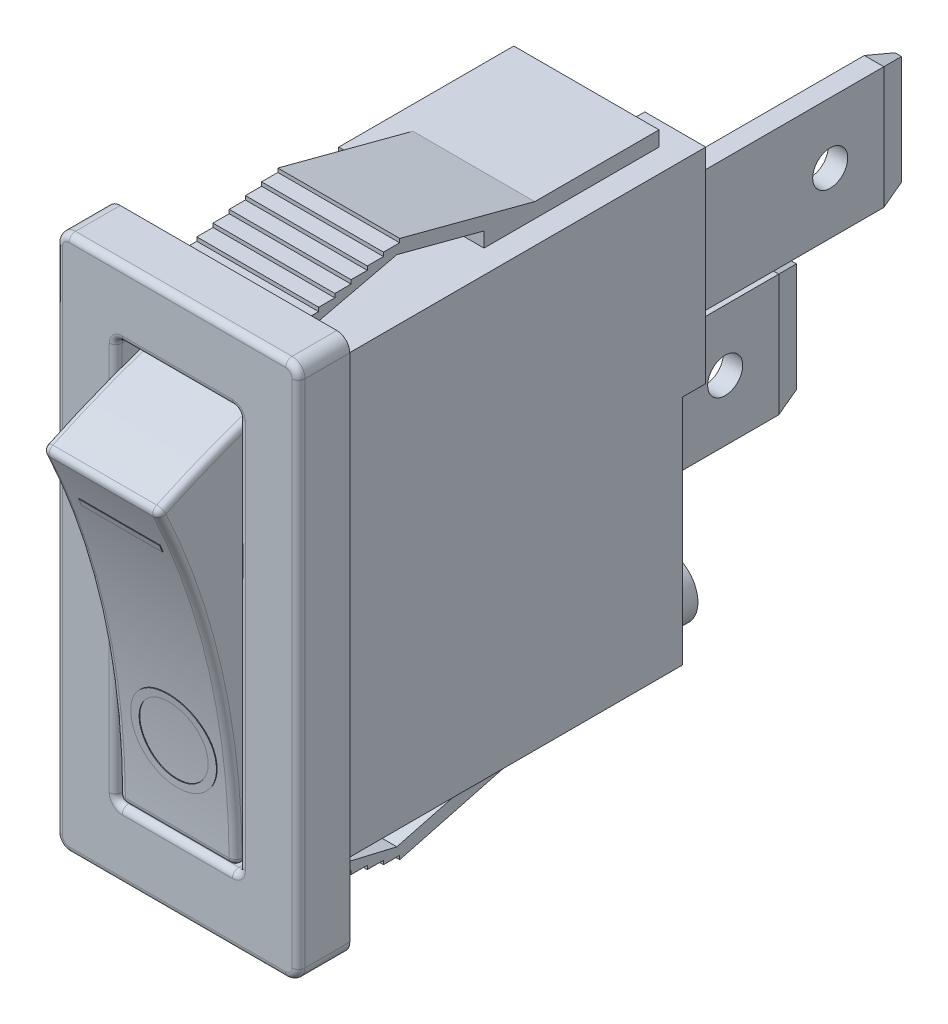
from build123d import *

# Parameters (mm, degrees)
EXTRUDE1_DEPTH      = 3.302
EXTRUDE2_DEPTH      = 2.3876
SKETCH5_W           = 0.9144
SKETCH5_H           = 0.5842
EXTRUDE3_DEPTH      = 19.210666352
SKETCH6_W           = 9.4996
SKETCH6_H           = 21.0058
SKETCH6_W_2         = 4.826
SKETCH6_H_2         = 15.748
EXTRUDE4_DEPTH      = 2.0066
FILLET1_R           = 0.508
FILLET2_R           = 0.254
SKETCH8_R           = 1.2192
EXTRUDE6_DEPTH      = 0.9144
SKETCH9_W           = 0.762
SKETCH9_H           = 4.7752
EXTRUDE7_DEPTH      = 9.7028
EXTRUDE7_2_DEPTH    = 9.7028
SKETCH10_R          = 0.6858
EXTRUDE8_DEPTH      = 28.340336298
CHAMFER1_SIZE       = 0.254
CHAMFER1_SIZE2      = 0.947940905
CHAMFER2_SIZE       = 0.254
CHAMFER2_SIZE2      = 0.947940905
EXTRUDE5_DEPTH      = 2.286
FILLET3_R           = 0.254
EXTRUDE9_REACH      = 34.854
EXTRUDE9_END_RADIUS = 31.334303465
EXTRUDE9_START      = -2.54
SKETCH12_W          = 3.175
SKETCH12_H          = 0.284935898


with BuildPart() as part:
    # Sketch3 → Extrude1 (new, symmetric)
    with BuildSketch(Plane(origin=(0, 0, 0), x_dir=(0, 0, -1), z_dir=(1, 0, 0))):
        Polygon((0, 8.5598), (0, -8.5598), (7.62, -8.5598), (7.62, -9.144), (14.478, -9.144), (14.478, 9.144), (7.62, 9.144), (7.62, 8.5598), align=None)
    extrude(amount=EXTRUDE1_DEPTH, both=True)

    # Sketch4 → Extrude2 (add, symmetric)
    with BuildSketch(Plane(origin=(0, 0, 0), x_dir=(0, 0, -1), z_dir=(1, 0, 0))):
        Polygon((7.62, 9.144), (4.20640573, 10.045056952), (0, 9.055314427), (0, 9.525), (0.508, 9.644529412), (1.143, 9.644529412), (1.143, 9.793941176), (1.778, 9.793941176), (1.778, 9.943352941), (2.413, 9.943352941), (2.413, 10.092764706), (3.048, 10.092764706), (3.048, 10.242176471), (3.683, 10.242176471), (3.683, 10.391588235), (4.318, 10.391588235), (4.318, 10.541), (9.610441485, 9.144), align=None)
        Polygon((1.143, -9.644529412), (0.508, -9.644529412), (0, -9.525), (0, -9.055314427), (4.20640573, -10.045056952), (7.62, -9.144), (9.610441485, -9.144), (4.318, -10.541), (4.318, -10.391588235), (3.683, -10.391588235), (3.683, -10.242176471), (3.048, -10.242176471), (3.048, -10.092764706), (2.413, -10.092764706), (2.413, -9.943352941), (1.778, -9.943352941), (1.778, -9.793941176), (1.143, -9.793941176), align=None)
    extrude(amount=EXTRUDE2_DEPTH, both=True)

    # Sketch5 → Extrude3 (cut, through all)
    with BuildSketch(Plane.XY):
        with Locations((2.8448, 8.8519)):
            Rectangle(SKETCH5_W, SKETCH5_H)
        with Locations((2.8448, -8.8519)):
            Rectangle(SKETCH5_W, SKETCH5_H)
    extrude(amount=-EXTRUDE3_DEPTH, mode=Mode.SUBTRACT)

    # Sketch6 → Extrude4 (add)
    with BuildSketch(Plane.XY):
        Rectangle(SKETCH6_W, SKETCH6_H)
        Rectangle(SKETCH6_W_2, SKETCH6_H_2, mode=Mode.SUBTRACT)
    extrude(amount=EXTRUDE4_DEPTH)

    # Fillet1
    fillet1_edges = [part.edges().sort_by_distance(p)[0] for p in [
        (-4.7498, 10.5029, 1.0033),
        (-4.7498, -10.5029, 1.0033),
        (4.7498, -10.5029, 1.0033),
        (4.7498, 10.5029, 1.0033),
    ]]
    fillet(fillet1_edges, radius=FILLET1_R)

    # Fillet2
    fillet2_edges = [part.edges().sort_by_distance(p)[0] for p in [
        (2.413, 0, 2.0066),
        (2.413, 7.874, 1.0033),
        (0, 7.874, 2.0066),
        (-2.413, 7.874, 1.0033),
        (-2.413, 0, 2.0066),
        (-2.413, -7.874, 1.0033),
        (0, -7.874, 2.0066),
        (2.413, -7.874, 1.0033),
        (-4.7498, 0, 2.0066),
        (0, 10.5029, 2.0066),
        (0, -10.5029, 2.0066),
        (4.7498, 0, 2.0066),
        (4.601010245, 10.354110245, 2.0066),
        (4.601010245, -10.354110245, 2.0066),
        (-4.601010245, -10.354110245, 2.0066),
        (-4.601010245, 10.354110245, 2.0066),
    ]]
    fillet(fillet2_edges, radius=FILLET2_R)

    # Sketch8 → Extrude6 (add)
    with BuildSketch(Plane(origin=(0, 0, -14.478), x_dir=(-1, 0, 0), z_dir=(0, 0, -1))):
        with Locations(Location((-1.778, -7.0358, 0), (0, 0, 180))):
            Circle(SKETCH8_R)
        Polygon((-0.9144, 2.8448), (-0.9144, 0.5334), (-3.302, 0.5334), (-3.302, 8.5598), (-0.9144, 8.5598), (-0.9144, 6.2484), (-2.4384, 6.2484), (-2.4384, 2.8448), align=None)
        Polygon((0.9144, -0.5334), (3.302, -0.5334), (3.302, -8.5598), (0.9144, -8.5598), (0.9144, -6.2484), (2.4384, -6.2484), (2.4384, -2.8448), (0.9144, -2.8448), align=None)
    extrude(amount=EXTRUDE6_DEPTH)


with BuildPart() as body_2:
    # Sketch9 → Extrude7 (new body)
    with BuildSketch(Plane(origin=(0, 0, -14.478), x_dir=(-1, 0, 0), z_dir=(0, 0, -1))):
        with Locations((-2.0574, 4.5466)):
            Rectangle(SKETCH9_W, SKETCH9_H)
    extrude(amount=EXTRUDE7_DEPTH)


with BuildPart() as body_3:
    # Sketch9 → Extrude7 2 (new body)
    with BuildSketch(Plane(origin=(0, 0, -14.478), x_dir=(-1, 0, 0), z_dir=(0, 0, -1))):
        with Locations((2.0574, -4.5466)):
            Rectangle(SKETCH9_W, SKETCH9_H)
    extrude(amount=EXTRUDE7_2_DEPTH)


with BuildPart() as extrude8_tool:
    # Sketch10 → Extrude8 (new, through all)
    with BuildSketch(Plane(origin=(2.4384, 0, 0), x_dir=(0, 0, -1), z_dir=(1, 0, 0))):
        with Locations(Location((21.1328, 4.5466, 0), (0, 0, 90))):
            Circle(SKETCH10_R)
        with Locations(Location((21.1328, -4.5466, 0), (0, 0, 180))):
            Circle(SKETCH10_R)
    extrude(amount=-EXTRUDE8_DEPTH)


with BuildPart() as body_2_1:
    add(body_2.part)

    # Extrude8: cut by extrude8_tool
    add(extrude8_tool.part, mode=Mode.SUBTRACT)

    # Chamfer1
    chamfer1_edges = [body_2_1.edges().sort_by_distance(p)[0] for p in [
        (1.6764, 4.5466, -24.1808),
        (2.0574, 6.9342, -24.1808),
        (2.4384, 4.5466, -24.1808),
        (2.0574, 2.159, -24.1808),
    ]]
    chamfer1_side = [body_2_1.faces().sort_by_distance(p)[0] for p in [
        (2.0574, 4.5466, -24.1808),
    ]]
    chamfer(chamfer1_edges, length=CHAMFER1_SIZE, length2=CHAMFER1_SIZE2, reference=chamfer1_side[0])


with BuildPart() as body_3_1:
    add(body_3.part)

    # Extrude8: cut by extrude8_tool
    add(extrude8_tool.part, mode=Mode.SUBTRACT)

    # Chamfer2
    chamfer2_edges = [body_3_1.edges().sort_by_distance(p)[0] for p in [
        (-1.6764, -4.5466, -24.1808),
        (-2.0574, -6.9342, -24.1808),
        (-2.4384, -4.5466, -24.1808),
        (-2.0574, -2.159, -24.1808),
    ]]
    chamfer2_side = [body_3_1.faces().sort_by_distance(p)[0] for p in [
        (-2.0574, -4.5466, -24.1808),
    ]]
    chamfer(chamfer2_edges, length=CHAMFER2_SIZE, length2=CHAMFER2_SIZE2, reference=chamfer2_side[0])


with BuildPart() as body_4:
    # Sketch7 → Extrude5 (new, symmetric)
    with BuildSketch(Plane(origin=(0, 0, 0), x_dir=(0, 0, -1), z_dir=(1, 0, 0))):
        with BuildLine():
            Line((3.419415582, -7.316747599), (0, 7.747))
            ThreePointArc((0, 7.747), (-2.578685969, 6.870258684), (-5.08, 5.792425309))
            ThreePointArc((-5.08, 5.792425309), (-2.784600682, -0.805065377), (-2.0066, -7.747))
            ThreePointArc((-2.0066, -7.747), (0.714923573, -7.639268351), (3.419415582, -7.316747599))
        make_face()
    extrude(amount=EXTRUDE5_DEPTH, both=True)

    # Fillet3
    fillet3_edges = [body_4.edges().sort_by_distance(p)[0] for p in [
        (2.286, -7.639268351, -0.714923573),
        (2.286, 6.870258684, 2.578685969),
        (-2.286, -7.639268351, -0.714923573),
        (-2.286, -0.805065377, 2.784600682),
        (-2.286, 6.870258684, 2.578685969),
        (2.286, -0.805065377, 2.784600682),
        (0, -7.747, 2.0066),
        (0, 5.792425309, 5.08),
    ]]
    fillet(fillet3_edges, radius=FILLET3_R)

    # Extrude9: up to this cylinder (the profile starts outside it)
    extrude9_end = Plane(origin=(-0.516007, -7.747, 33.366303465), z_dir=(-1, 0, 0)) * Cylinder(EXTRUDE9_END_RADIUS, 134.53562093, mode=Mode.PRIVATE)
    # Sketch12 → Extrude9 (add, up to the surface)
    with BuildSketch(Plane(origin=(0, -0.800620142, 3.527017833), x_dir=(1, 0, 0), z_dir=(0, -0.22136480439331788, 0.9751910701887647)).offset(EXTRUDE9_START), mode=Mode.PRIVATE) as extrude9_sk1:
        with Locations((0.0635, 4.79734566)):
            Rectangle(SKETCH12_W, SKETCH12_H)
    extrude9_tool1 = extrude(extrude9_sk1.sketch, amount=EXTRUDE9_REACH, mode=Mode.PRIVATE) - extrude9_end
    add(extrude9_tool1.solids().sort_by_distance((0.0635, 4.439975, 2.111996))[0])
    # Sketch12 → Extrude9 (add, up to the surface)
    with BuildSketch(Plane(origin=(0, -0.800620142, 3.527017833), x_dir=(1, 0, 0), z_dir=(0, -0.22136480439331788, 0.9751910701887647)).offset(EXTRUDE9_START), mode=Mode.PRIVATE) as extrude9_sk2:
        with BuildLine():
            add(Edge.make_bspline(
                [(-1.605410256, -3.791436391), (-1.603946268, -3.732639771), (-1.601070873, -3.617158358), (-1.578333531, -3.447593834), (-1.540910245, -3.2852282), (-1.488060574, -3.129968112), (-1.419547617, -2.982404064), (-1.336323995, -2.842119296), (-1.237883943, -2.709534227), (-1.125672957, -2.585561494), (-1.002783615, -2.47246964), (-0.871228244, -2.373230951), (-0.732660841, -2.289513752), (-0.58707418, -2.220982107), (-0.434808165, -2.167180223), (-0.275009423, -2.130063415), (-0.108724587, -2.106351666), (0.004692712, -2.103579737), (0.062227965, -2.102173571)],
                knots=[0, 0, 0, 0, 1.065064174, 2.09187391, 3.093564831, 4.079973196, 5.057907931, 6.036227367, 7.030399151, 8.044883615, 9.061699972, 10.052012555, 11.025713132, 11.989727027, 12.962874294, 13.945865945, 14.957962116, 16, 16, 16, 16], degree=3))
            add(Edge.make_bspline(
                [(0.062227965, -2.102173571), (0.119339066, -2.10358021), (0.231911664, -2.10635286), (0.397146033, -2.130082655), (0.555962724, -2.16734584), (0.708007756, -2.220315966), (0.853298725, -2.2889002), (0.991971027, -2.372740643), (1.123877784, -2.471790988), (1.247613733, -2.584402596), (1.360803478, -2.707526044), (1.460641242, -2.83857581), (1.544394885, -2.977139518), (1.613691624, -3.121781238), (1.666372285, -3.273636742), (1.704725545, -3.431600976), (1.728201904, -3.596534581), (1.730992079, -3.708888805), (1.732410256, -3.765995686)],
                knots=[0, 0, 0, 0, 1.043748596, 2.057349401, 3.045489418, 4.02252776, 4.995289225, 5.97782527, 6.980224157, 8.006516136, 9.032559198, 10.034193337, 11.013412982, 11.987833483, 12.961212594, 13.946489799, 14.956251404, 16, 16, 16, 16], degree=3))
            add(Edge.make_bspline(
                [(1.732410256, -3.765995686), (1.731004741, -3.823530604), (1.728234097, -3.936947243), (1.704483822, -4.103441553), (1.667344211, -4.26335065), (1.614267794, -4.41621724), (1.545672163, -4.562126569), (1.462029619, -4.701364001), (1.362781713, -4.833370656), (1.250144891, -4.957052097), (1.127524983, -5.070217441), (0.996139623, -5.168877732), (0.858566459, -5.252539085), (0.714423705, -5.320904394), (0.564408182, -5.375028582), (0.407519206, -5.411953667), (0.244651226, -5.435844138), (0.133759454, -5.438597177), (0.077492388, -5.439994084)],
                knots=[0, 0, 0, 0, 1.053102029, 2.075944431, 3.073151272, 4.055350789, 5.033113405, 6.020478099, 7.024410459, 8.052272461, 9.079885166, 10.07527673, 11.055994387, 12.023226415, 12.992069828, 13.970394897, 14.97016774, 16, 16, 16, 16], degree=3))
            add(Edge.make_bspline(
                [(0.077492388, -5.439994084), (0.039725609, -5.439509093), (-0.035331503, -5.43854523), (-0.146789061, -5.426941337), (-0.256454158, -5.410103222), (-0.364014947, -5.385971487), (-0.469208126, -5.354410475), (-0.572759175, -5.317170422), (-0.673618696, -5.271686419), (-0.772264487, -5.220268974), (-0.867158801, -5.162881477), (-0.956856709, -5.09949419), (-1.042110899, -5.032333534), (-1.120712109, -4.958706742), (-1.194946926, -4.881040395), (-1.263674534, -4.79807458), (-1.327514668, -4.710315544), (-1.385045977, -4.617385671), (-1.437078906, -4.521574808), (-1.481730157, -4.422808016), (-1.52005337, -4.322426698), (-1.55111469, -4.219960696), (-1.575636608, -4.11568211), (-1.592334708, -4.009363348), (-1.603968196, -3.901089111), (-1.604927501, -3.828144558), (-1.605410256, -3.791436391)],
                knots=[0, 0, 0, 0, 1.037015668, 2.060948919, 3.074880161, 4.083647147, 5.086022904, 6.090072063, 7.104153813, 8.122640571, 9.144368836, 10.147691507, 11.138137339, 12.123020368, 13.103399296, 14.087645067, 15.080126199, 16.082011238, 17.087798457, 18.072939717, 19.057185487, 20.037253025, 21.01195951, 21.997135196, 22.992090687, 24, 24, 24, 24], degree=3))
        make_face()
        with BuildLine():
            add(Edge.make_bspline(
                [(-1.279769231, -3.777444003), (-1.279403218, -3.807574806), (-1.278674693, -3.867548359), (-1.269025783, -3.956700778), (-1.255372125, -4.044707768), (-1.235542225, -4.131399025), (-1.209893112, -4.216956356), (-1.178958257, -4.301417747), (-1.141568849, -4.384493605), (-1.099519916, -4.466080147), (-1.051759056, -4.54429299), (-1.001041686, -4.619320493), (-0.945483384, -4.689211128), (-0.88628568, -4.754924996), (-0.822934832, -4.816298674), (-0.755846871, -4.873305089), (-0.684731624, -4.925897495), (-0.60988176, -4.973442964), (-0.531715182, -5.015754721), (-0.451726099, -5.05363821), (-0.368974472, -5.085042178), (-0.283976697, -5.109918799), (-0.197107339, -5.13103335), (-0.107893104, -5.144277959), (-0.016641544, -5.154021941), (0.045028061, -5.154710112), (0.076220353, -5.155058186)],
                knots=[0, 0, 0, 0, 1.008406545, 2.007172654, 2.999155034, 3.989332444, 4.982025741, 5.988181096, 6.998684226, 8.030553839, 9.059268815, 10.065399129, 11.060956322, 12.046057109, 13.024974577, 14.012068307, 14.991706172, 15.984221787, 16.978487447, 17.966117052, 18.945677757, 19.938371053, 20.93015022, 21.936155317, 22.956113857, 24, 24, 24, 24], degree=3))
            add(Edge.make_bspline(
                [(0.076220353, -5.155058186), (0.122086467, -5.153899058), (0.212319304, -5.151618695), (0.344566713, -5.131737794), (0.47178581, -5.100870731), (0.59321832, -5.056119321), (0.709405743, -4.999030067), (0.81989592, -4.929392766), (0.924656257, -4.846569689), (1.022906919, -4.752545282), (1.11254849, -4.649732071), (1.191343902, -4.540611898), (1.257660318, -4.426048081), (1.313099352, -4.306700937), (1.354864813, -4.181551501), (1.384643568, -4.051402181), (1.403944025, -3.916250102), (1.405818558, -3.824151794), (1.406769231, -3.777444003)],
                knots=[0, 0, 0, 0, 1.032022337, 2.030307203, 3.003823408, 3.974715386, 4.937372378, 5.913284036, 6.909147208, 7.938749767, 8.970518239, 9.975863271, 10.963918693, 11.946286286, 12.933361397, 13.927862637, 14.949112547, 16, 16, 16, 16], degree=3))
            add(Edge.make_bspline(
                [(1.406769231, -3.777444003), (1.406338228, -3.746048118), (1.405483421, -3.683780647), (1.396861665, -3.591167233), (1.383063322, -3.500213732), (1.363098419, -3.411088195), (1.338441963, -3.323673846), (1.30785817, -3.238234448), (1.271195533, -3.154798377), (1.230336237, -3.072955359), (1.183921178, -2.99453794), (1.133887526, -2.919965537), (1.079309529, -2.850195312), (1.020906876, -2.784512276), (0.957750767, -2.723568725), (0.891070525, -2.666724618), (0.819804343, -2.61504155), (0.745261047, -2.56765726), (0.667664351, -2.524829236), (0.587455361, -2.488041537), (0.505064264, -2.456624081), (0.420430526, -2.431298052), (0.333744523, -2.41144235), (0.244882189, -2.397763377), (0.154023455, -2.388194255), (0.092570086, -2.387473031), (0.061591947, -2.387109468)],
                knots=[0, 0, 0, 0, 1.047334373, 2.07717862, 3.100662057, 4.115010574, 5.122652213, 6.129548646, 7.140165612, 8.16200981, 9.179904151, 10.178566626, 11.156366481, 12.133321541, 13.108841334, 14.082538371, 15.054589433, 16.043660176, 17.028268541, 18.009491307, 18.985652105, 19.968123554, 20.954864208, 21.950389976, 22.966808393, 24, 24, 24, 24], degree=3))
            add(Edge.make_bspline(
                [(0.061591947, -2.387109468), (0.03082574, -2.387473335), (-0.0302047, -2.388195132), (-0.120429871, -2.397758662), (-0.208652427, -2.411457327), (-0.29452602, -2.431199212), (-0.37807254, -2.456644708), (-0.459213513, -2.488020361), (-0.538251252, -2.525018441), (-0.614990293, -2.567480237), (-0.688627643, -2.615210123), (-0.759023129, -2.667366289), (-0.824860662, -2.724845197), (-0.887743336, -2.786019641), (-0.946413365, -2.852360386), (-1.00064406, -2.923879011), (-1.052878873, -2.998794795), (-1.099107262, -3.078801904), (-1.142012847, -3.161075922), (-1.178617897, -3.245575954), (-1.21005645, -3.331095216), (-1.235618793, -3.41797563), (-1.255296167, -3.506176129), (-1.269038001, -3.59564542), (-1.278671379, -3.686071206), (-1.279402119, -3.746889752), (-1.279769231, -3.777444003)],
                knots=[0, 0, 0, 0, 1.029877221, 2.042951179, 3.035109885, 4.018542222, 4.991021277, 5.957494829, 6.929429462, 7.911425532, 8.892163142, 9.866273635, 10.842761649, 11.81676864, 12.802607151, 13.805177466, 14.821356543, 15.858816981, 16.897175917, 17.927346774, 18.940346092, 19.946830556, 20.957962087, 21.964146003, 22.97721996, 24, 24, 24, 24], degree=3))
        make_face(mode=Mode.SUBTRACT)
    extrude9_tool2 = extrude(extrude9_sk2.sketch, amount=EXTRUDE9_REACH, mode=Mode.PRIVATE) - extrude9_end
    add(extrude9_tool2.solids().sort_by_distance((-1.095514, -2.799052, 0.468763))[0])


solid = Compound([part.part, body_2_1.part, body_3_1.part, body_4.part])
